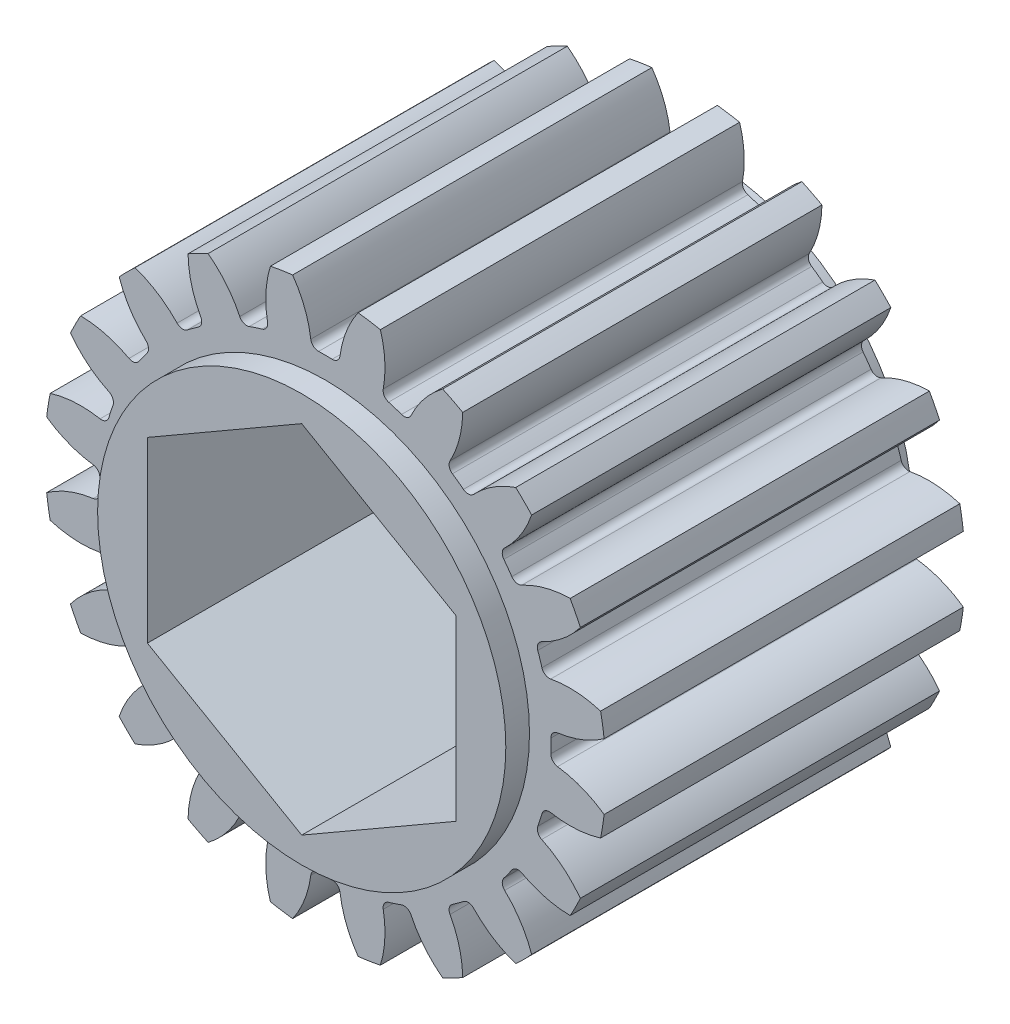
from build123d import *

# Parameters (mm, degrees)
CROQUIS1_R                 = 8.73125
SALIENTE_EXTRUIR1_DEPTH    = 5.588
CORTAR_EXTRUIR1_DEPTH      = 14.553420126
REDONDEO1_R                = 0.238142541
MATRIZC1_COUNT             = 20
REDONDEO1_OF_MATRIZC1_R    = 0.238142541
CROQUIS3_R                 = 6.35
SALIENTE_EXTRUIR2_DEPTH    = 6.3246
CORTAR_EXTRUIR2_DEPTH      = 14.798272874
CORTAR_EXTRUIR2_DEPTH_BACK = 14.798272874


with BuildPart() as part:
    # Croquis1 → Saliente-Extruir1 (new, symmetric)
    with BuildSketch(Plane.XY):
        Circle(CROQUIS1_R)
    extrude(amount=SALIENTE_EXTRUIR1_DEPTH, both=True)

    # Croquis2 → Cortar-Extruir1 (cut, symmetric)
    with BuildSketch(Plane.XY):
        with BuildLine():
            ThreePointArc((0.433697388, 7.005719812), (0, 7.01913125), (-0.433697388, 7.005719812))
            ThreePointArc((-0.433697388, 7.005719812), (-0.61071183, 7.879325733), (-1.019236832, 8.671555964))
            ThreePointArc((-1.019236832, 8.671555964), (0, 8.73125), (1.019236832, 8.671555964))
            ThreePointArc((1.019236832, 8.671555964), (0.61071183, 7.879325733), (0.433697388, 7.005719812))
        make_face()
    cortar_extruir1 = extrude(amount=CORTAR_EXTRUIR1_DEPTH, both=True, mode=Mode.SUBTRACT)

    # Redondeo1
    redondeo1_edges = [part.edges().sort_by_distance(p)[0] for p in [
        (0.433697388, 7.005719812, 0),
        (-0.433697388, 7.005719812, 0),
    ]]
    fillet(redondeo1_edges, radius=REDONDEO1_R)

    # MatrizC1: Cortar-Extruir1 ×20 about axis
    matrizc1_axis = Axis((0, 0, 0), (0, 0, 1))
    for i in range(1, MATRIZC1_COUNT):
        add(cortar_extruir1.rotate(matrizc1_axis, i * 360 / MATRIZC1_COUNT), mode=Mode.SUBTRACT)

    # Redondeo1 of MatrizC1
    redondeo1_of_matrizc1_edges = [part.edges().sort_by_distance(p)[0] for p in [
        (-1.752415753, 6.796855342, 0),
        (-2.577357206, 6.528815615, 0),
        (-3.76699023, 5.922667314, 0),
        (-4.468727344, 5.412825457, 0),
        (-5.412825457, 4.468727344, 0),
        (-5.922667314, 3.76699023, 0),
        (-6.528815615, 2.577357206, 0),
        (-6.796855342, 1.752415753, 0),
        (-7.005719812, 0.433697388, 0),
        (-7.005719812, -0.433697388, 0),
        (-6.796855342, -1.752415753, 0),
        (-6.528815615, -2.577357206, 0),
        (-5.922667314, -3.76699023, 0),
        (-5.412825457, -4.468727344, 0),
        (-4.468727344, -5.412825457, 0),
        (-3.76699023, -5.922667314, 0),
        (-2.577357206, -6.528815615, 0),
        (-1.752415753, -6.796855342, 0),
        (-0.433697388, -7.005719812, 0),
        (0.433697388, -7.005719812, 0),
        (1.752415753, -6.796855342, 0),
        (2.577357206, -6.528815615, 0),
        (3.76699023, -5.922667314, 0),
        (4.468727344, -5.412825457, 0),
        (5.412825457, -4.468727344, 0),
        (5.922667314, -3.76699023, 0),
        (6.528815615, -2.577357206, 0),
        (6.796855342, -1.752415753, 0),
        (7.005719812, -0.433697388, 0),
        (7.005719812, 0.433697388, 0),
        (6.796855342, 1.752415753, 0),
        (6.528815615, 2.577357206, 0),
        (5.922667314, 3.76699023, 0),
        (5.412825457, 4.468727344, 0),
        (4.468727344, 5.412825457, 0),
        (3.76699023, 5.922667314, 0),
        (2.577357206, 6.528815615, 0),
        (1.752415753, 6.796855342, 0),
    ]]
    fillet(redondeo1_of_matrizc1_edges, radius=REDONDEO1_OF_MATRIZC1_R)

    # Croquis3 → Saliente-Extruir2 (add, symmetric)
    with BuildSketch(Plane.XY):
        Circle(CROQUIS3_R)
    extrude(amount=SALIENTE_EXTRUIR2_DEPTH, both=True)

    # Croquis4 → Cortar-Extruir2 (cut, two sides: drawn at the far end of the back side and taken through both)
    with BuildSketch(Plane.XY.offset(-CORTAR_EXTRUIR2_DEPTH_BACK)):
        Polygon((0, 5.543255405), (-4.8006, 2.771627702), (-4.8006, -2.771627702), (0, -5.543255405), (4.8006, -2.771627702), (4.8006, 2.771627702), align=None)
    extrude(amount=CORTAR_EXTRUIR2_DEPTH + CORTAR_EXTRUIR2_DEPTH_BACK, mode=Mode.SUBTRACT)


solid = part.part
